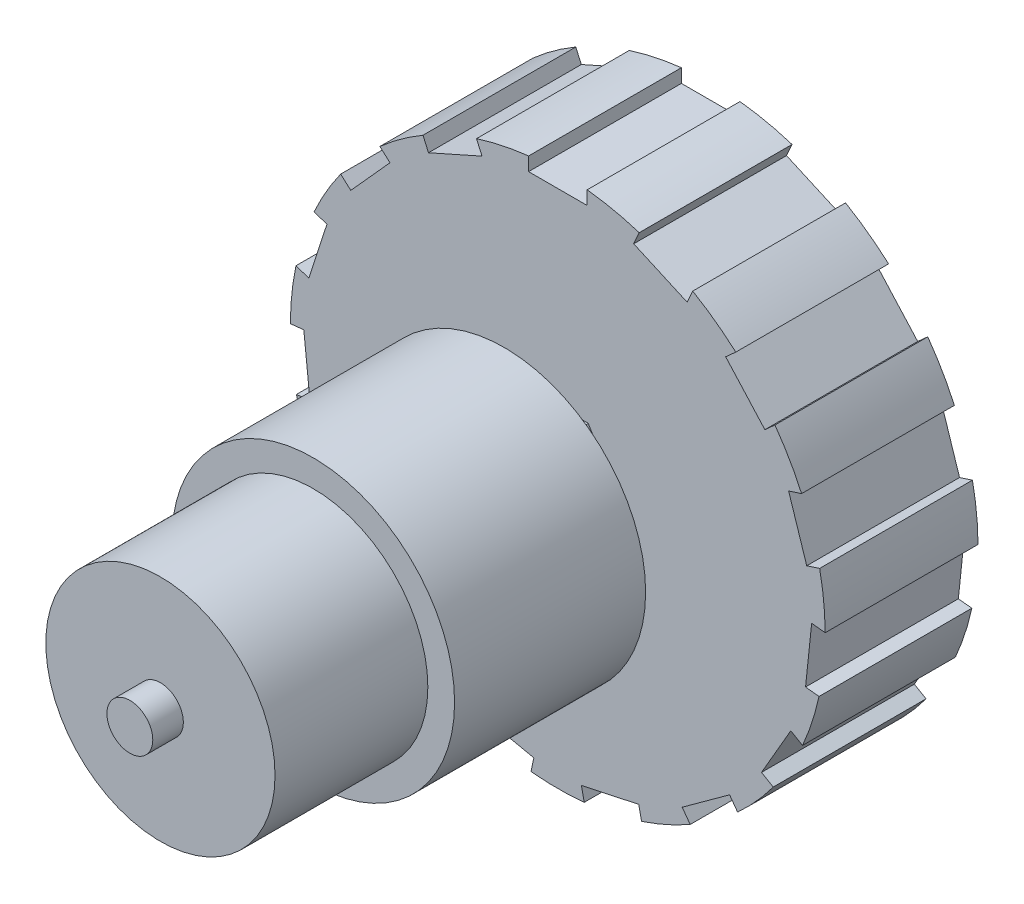
from build123d import *

# Parameters (mm, degrees)
SKETCH1_R           = 18.5
BOSS_EXTRUDE1_DEPTH = 25
SKETCH2_R           = 15
BOSS_EXTRUDE2_DEPTH = 20
SKETCH10_R          = 7.5
BOSS_EXTRUDE8_DEPTH = 12
SKETCH7_R           = 7.5
BOSS_EXTRUDE6_DEPTH = 3
SKETCH4_R           = 3
BOSS_EXTRUDE4_DEPTH = 22
SKETCH5_R           = 1.90826202
CUT_EXTRUDE1_DEPTH  = 22
SKETCH6_R           = 3
BOSS_EXTRUDE5_DEPTH = 4
SKETCH8_R           = 35
BOSS_EXTRUDE7_DEPTH = 20
SKETCH9_W           = 7.665881166
SKETCH9_H           = 2.190251761
CUT_EXTRUDE2_DEPTH  = 20
CIRPATTERN1_COUNT   = 15


with BuildPart() as part:
    # Sketch1 → Boss-Extrude1 (new body)
    with BuildSketch(Plane.XY):
        Circle(SKETCH1_R)
    extrude(amount=BOSS_EXTRUDE1_DEPTH)

    # Sketch2 → Boss-Extrude2 (add)
    with BuildSketch(Plane.XY.offset(25)):
        Circle(SKETCH2_R)
    extrude(amount=BOSS_EXTRUDE2_DEPTH)

    # Sketch10 → Boss-Extrude8 (add)
    with BuildSketch(Plane(origin=(0, 0, 0), x_dir=(-1, 0, 0), z_dir=(0, 0, -1))):
        Circle(SKETCH10_R)
    extrude(amount=BOSS_EXTRUDE8_DEPTH)

    # Sketch6 → Boss-Extrude5 (add)
    with BuildSketch(Plane.XY.offset(45)):
        with Locations(Location((0, 0, 0), (0, 0, 180))):
            Circle(SKETCH6_R)
    extrude(amount=BOSS_EXTRUDE5_DEPTH)


with BuildPart() as body_2:
    # Sketch7 → Boss-Extrude6 (new body)
    with BuildSketch(Plane(origin=(0, 0, -2), x_dir=(-1, 0, 0), z_dir=(0, 0, -1))):
        Polygon((12, 0), (6, 10.392304845), (-6, 10.392304845), (-12, 0), (-6, -10.392304845), (6, -10.392304845), align=None)
        Circle(SKETCH7_R, mode=Mode.SUBTRACT)
    extrude(amount=BOSS_EXTRUDE6_DEPTH)


with BuildPart() as body_3:
    # Sketch4 → Boss-Extrude4 (new body)
    with BuildSketch(Plane(origin=(0, 0, -5), x_dir=(-1, 0, 0), z_dir=(0, 0, -1))):
        Circle(SKETCH4_R)
    extrude(amount=BOSS_EXTRUDE4_DEPTH)

    # Sketch5 → Cut-Extrude1 (cut)
    with BuildSketch(Plane(origin=(-0.01048154, 7.617602547, 0), x_dir=(0.9999990533641856, 0.0013759617482230274, 0), z_dir=(-0.0013759617482230274, 0.9999990533641857, 0))):
        with Locations(Location((-0.062479022, 19, 0), (0, 0, 180))):
            Circle(SKETCH5_R)
    extrude(amount=-CUT_EXTRUDE1_DEPTH, mode=Mode.SUBTRACT)

    # Sketch8 → Boss-Extrude7 (add)
    with BuildSketch(Plane(origin=(0, 0, -7), x_dir=(-1, 0, 0), z_dir=(0, 0, -1))):
        Circle(SKETCH8_R)
    extrude(amount=BOSS_EXTRUDE7_DEPTH)

    # Sketch9 → Cut-Extrude2 (cut)
    with BuildSketch(Plane(origin=(0, 0, -27), x_dir=(-1, 0, 0), z_dir=(0, 0, -1))):
        with Locations((-0.015351428, 34.106719759)):
            Rectangle(SKETCH9_W, SKETCH9_H)
    cut_extrude2 = extrude(amount=-CUT_EXTRUDE2_DEPTH, mode=Mode.SUBTRACT)

    # CirPattern1: Cut-Extrude2 ×15 about axis
    cirpattern1_axis = Axis((0, 0, 0), (0, 0, 1))
    for i in range(1, CIRPATTERN1_COUNT):
        add(cut_extrude2.rotate(cirpattern1_axis, i * 360 / CIRPATTERN1_COUNT), mode=Mode.SUBTRACT)


solid = Compound([part.part, body_2.part, body_3.part])
